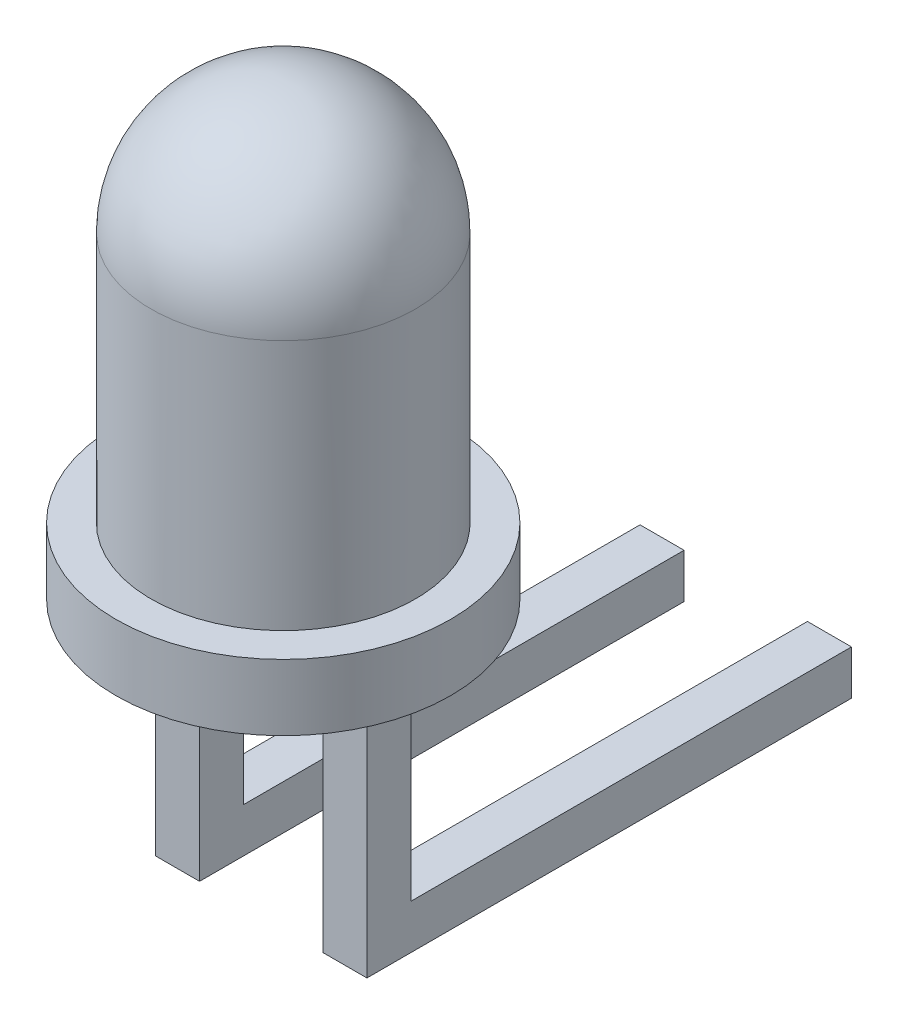
from build123d import *

# Parameters (mm, degrees)
SKICA2_W                = 0.5
SKICA2_H                = 3
P_IDAT_VYSUNUT_M1_DEPTH = 0.25
SKICA3_W                = 0.5
SKICA3_H                = 0.504797781
P_IDAT_VYSUNUT_M2_DEPTH = 5


with BuildPart() as part:
    # Skica1 → Rotovat1 (revolve)
    with BuildSketch(Plane.XY):
        with BuildLine():
            Line((-1.5, 6.066522781), (-1.5, 3.216522781))
            Line((-1.5, 3.216522781), (-1.9, 3.216522781))
            Line((-1.9, 3.216522781), (-1.9, 2.466522781))
            Line((-1.9, 2.466522781), (0, 2.466522781))
            Line((0, 2.466522781), (0, 7.566522781))
            ThreePointArc((0, 7.566522781), (-1.060660172, 7.127182953), (-1.5, 6.066522781))
        make_face()
    revolve(axis=Axis((0, 7.566522781, 0), (0, -1, 0)))

    # Skica2 → Přidat vysunutím1 (add, symmetric)
    with BuildSketch(Plane.XY):
        with Locations((0.95, 0.966522781)):
            Rectangle(SKICA2_W, SKICA2_H)
        with Locations((-0.95, 0.966522781)):
            Rectangle(SKICA2_W, SKICA2_H)
    extrude(amount=P_IDAT_VYSUNUT_M1_DEPTH, both=True)

    # Skica3 → Přidat vysunutím2 (add)
    with BuildSketch(Plane(origin=(0, 0, -0.25), x_dir=(-1, 0, 0), z_dir=(0, 0, -1))):
        with Locations((0.95, -0.281078329)):
            Rectangle(SKICA3_W, SKICA3_H)
        with Locations((-0.95, -0.281078329)):
            Rectangle(SKICA3_W, SKICA3_H)
    extrude(amount=P_IDAT_VYSUNUT_M2_DEPTH)


solid = part.part
